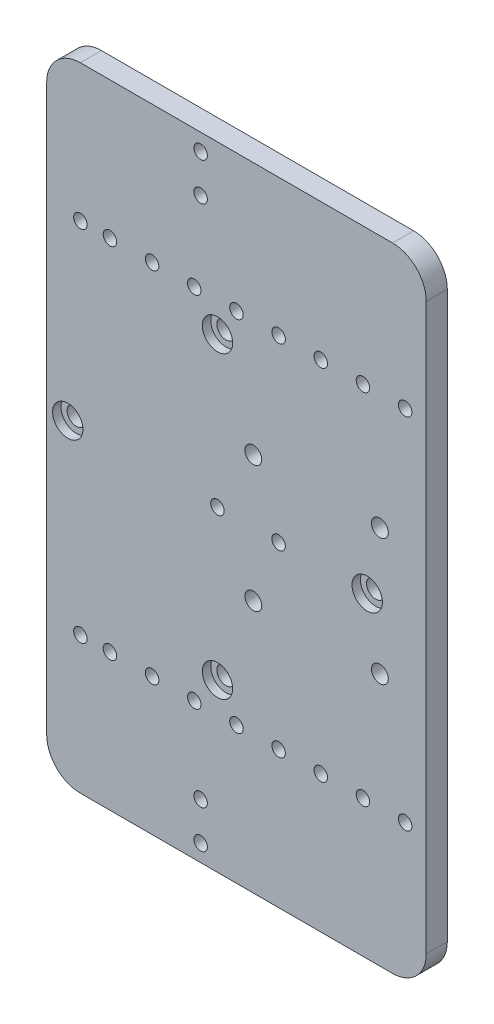
from build123d import *

# Parameters (mm, degrees)
SKETCH_1_W          = 90
SKETCH_1_H          = 150
SKETCH_1_R          = 2
SKETCH_1_R_2        = 2.15
SKETCH_1_R_3        = 1.6
EXTRUDE_1_DEPTH     = 5
FILLET_1_R          = 8
SKETCH_2_R          = 3.6
CUT_EXTRUDE_1_DEPTH = 2
SKETCH_4_R          = 30
EXTRUDE_2_DEPTH     = 4
SKETCH_5_R          = 4
CUT_EXTRUDE_2_DEPTH = 6


with BuildPart() as part:
    # 草图1 → 凸台-拉伸1 (new body)
    with BuildSketch(Plane.XY):
        with Locations((45, -75)):
            Rectangle(SKETCH_1_W, SKETCH_1_H)
        with Locations((79, -60)):
            Circle(SKETCH_1_R, mode=Mode.SUBTRACT)
        with Locations((79, -90)):
            Circle(SKETCH_1_R, mode=Mode.SUBTRACT)
        with Locations((49, -60)):
            Circle(SKETCH_1_R, mode=Mode.SUBTRACT)
        with Locations((49, -90)):
            Circle(SKETCH_1_R, mode=Mode.SUBTRACT)
        with Locations((40.5, -39.5)):
            Circle(SKETCH_1_R_2, mode=Mode.SUBTRACT)
        with Locations((40.5, -110.5)):
            Circle(SKETCH_1_R_2, mode=Mode.SUBTRACT)
        with Locations((76, -75)):
            Circle(SKETCH_1_R_2, mode=Mode.SUBTRACT)
        with Locations((5, -75)):
            Circle(SKETCH_1_R_2, mode=Mode.SUBTRACT)
        with Locations((85, -117.5)):
            Circle(SKETCH_1_R_3, mode=Mode.SUBTRACT)
        with Locations((75, -117.5)):
            Circle(SKETCH_1_R_3, mode=Mode.SUBTRACT)
        with Locations((65, -117.5)):
            Circle(SKETCH_1_R_3, mode=Mode.SUBTRACT)
        with Locations((55, -117.5)):
            Circle(SKETCH_1_R_3, mode=Mode.SUBTRACT)
        with Locations((45, -117.5)):
            Circle(SKETCH_1_R_3, mode=Mode.SUBTRACT)
        with Locations((85, -32.5)):
            Circle(SKETCH_1_R_3, mode=Mode.SUBTRACT)
        with Locations((75, -32.5)):
            Circle(SKETCH_1_R_3, mode=Mode.SUBTRACT)
        with Locations((65, -32.5)):
            Circle(SKETCH_1_R_3, mode=Mode.SUBTRACT)
        with Locations((55, -32.5)):
            Circle(SKETCH_1_R_3, mode=Mode.SUBTRACT)
        with Locations((45, -32.5)):
            Circle(SKETCH_1_R_3, mode=Mode.SUBTRACT)
        with Locations((35, -117.5)):
            Circle(SKETCH_1_R_3, mode=Mode.SUBTRACT)
        with Locations((25, -117.5)):
            Circle(SKETCH_1_R_3, mode=Mode.SUBTRACT)
        with Locations((15, -117.5)):
            Circle(SKETCH_1_R_3, mode=Mode.SUBTRACT)
        with Locations((35, -32.5)):
            Circle(SKETCH_1_R_3, mode=Mode.SUBTRACT)
        with Locations((25, -32.5)):
            Circle(SKETCH_1_R_3, mode=Mode.SUBTRACT)
        with Locations((15, -32.5)):
            Circle(SKETCH_1_R_3, mode=Mode.SUBTRACT)
        with Locations((8, -117.5)):
            Circle(SKETCH_1_R_3, mode=Mode.SUBTRACT)
        with Locations((8, -32.5)):
            Circle(SKETCH_1_R_3, mode=Mode.SUBTRACT)
        with Locations((36.5, -4)):
            Circle(SKETCH_1_R_3, mode=Mode.SUBTRACT)
        with Locations((36.5, -13)):
            Circle(SKETCH_1_R_3, mode=Mode.SUBTRACT)
        with Locations((36.5, -137)):
            Circle(SKETCH_1_R_3, mode=Mode.SUBTRACT)
        with Locations((36.5, -146)):
            Circle(SKETCH_1_R_3, mode=Mode.SUBTRACT)
        with Locations((55, -75)):
            Circle(SKETCH_1_R_3, mode=Mode.SUBTRACT)
        with Locations((40.5, -75)):
            Circle(SKETCH_1_R_3, mode=Mode.SUBTRACT)
    extrude(amount=EXTRUDE_1_DEPTH)

    # 圆角1
    fillet_1_edges = [part.edges().sort_by_distance(p)[0] for p in [
        (0, 0, 2.5),
        (90, 0, 2.5),
        (90, -150, 2.5),
        (0, -150, 2.5),
    ]]
    fillet(fillet_1_edges, radius=FILLET_1_R)

    # 草图2 → 切除-拉伸1 (cut)
    with BuildSketch(Plane.XY.offset(5)):
        with Locations((40.5, -39.5)):
            Circle(SKETCH_2_R)
        with Locations((76, -75)):
            Circle(SKETCH_2_R)
        with Locations((5, -75)):
            Circle(SKETCH_2_R)
        with Locations((40.5, -110.5)):
            Circle(SKETCH_2_R)
    extrude(amount=-CUT_EXTRUDE_1_DEPTH, mode=Mode.SUBTRACT)

    # 草图4 → 凸台-拉伸2 (add)
    with BuildSketch(Plane(origin=(0, 0, 0), x_dir=(-1, 0, 0), z_dir=(0, 0, -1))):
        with BuildLine():
            ThreePointArc((-42.199612772, -35.036124857), (-68.784271247, -46.715728753), (-80.463875143, -73.300387228))
            ThreePointArc((-80.463875143, -73.300387228), (-71.223509147, -75), (-80.463875143, -76.699612772))
            ThreePointArc((-80.463875143, -76.699612772), (-68.784271247, -103.284271247), (-42.199612772, -114.963875143))
            ThreePointArc((-42.199612772, -114.963875143), (-40.5, -105.723509147), (-38.800387228, -114.963875143))
            ThreePointArc((-38.800387228, -114.963875143), (-12.215728753, -103.284271247), (-0.536124857, -76.699612772))
            ThreePointArc((-0.536124857, -76.699612772), (-9.776490853, -75), (-0.536124857, -73.300387228))
            ThreePointArc((-0.536124857, -73.300387228), (-12.215728753, -46.715728753), (-38.800387228, -35.036124857))
            ThreePointArc((-38.800387228, -35.036124857), (-40.5, -44.276490853), (-42.199612772, -35.036124857))
        make_face()
        with Locations((-40.5, -75)):
            Circle(SKETCH_4_R, mode=Mode.SUBTRACT)
    extrude(amount=EXTRUDE_2_DEPTH)

    # 草图5 → 切除-拉伸2 (cut)
    with BuildSketch(Plane(origin=(0, 0, -4), x_dir=(-1, 0, 0), z_dir=(0, 0, -1))):
        with Locations((-79, -60)):
            Circle(SKETCH_5_R)
        with Locations((-79, -90)):
            Circle(SKETCH_5_R)
    extrude(amount=-CUT_EXTRUDE_2_DEPTH, mode=Mode.SUBTRACT)


solid = part.part
